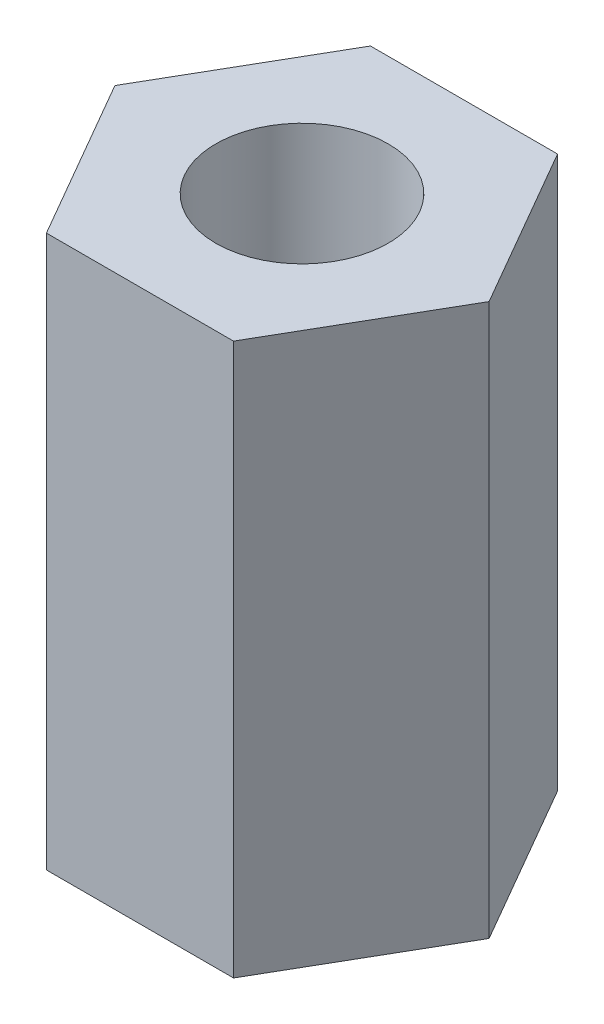
from build123d import *

# Parameters (mm, degrees)
SKETCH1_R           = 1.25
BOSS_EXTRUDE1_DEPTH = 8


with BuildPart() as part:
    # Sketch1 → Boss-Extrude1 (new body)
    with BuildSketch(Plane(origin=(0, 0, 0), x_dir=(1, 0, 0), z_dir=(0, 1, 0))):
        Polygon((2.713546265, 0), (1.356773133, 2.35), (-1.356773133, 2.35), (-2.713546265, 0), (-1.356773133, -2.35), (1.356773133, -2.35), align=None)
        with Locations(Location((0, 0, 0), (0, 0, 270))):
            Circle(SKETCH1_R, mode=Mode.SUBTRACT)
    extrude(amount=BOSS_EXTRUDE1_DEPTH)


solid = part.part
